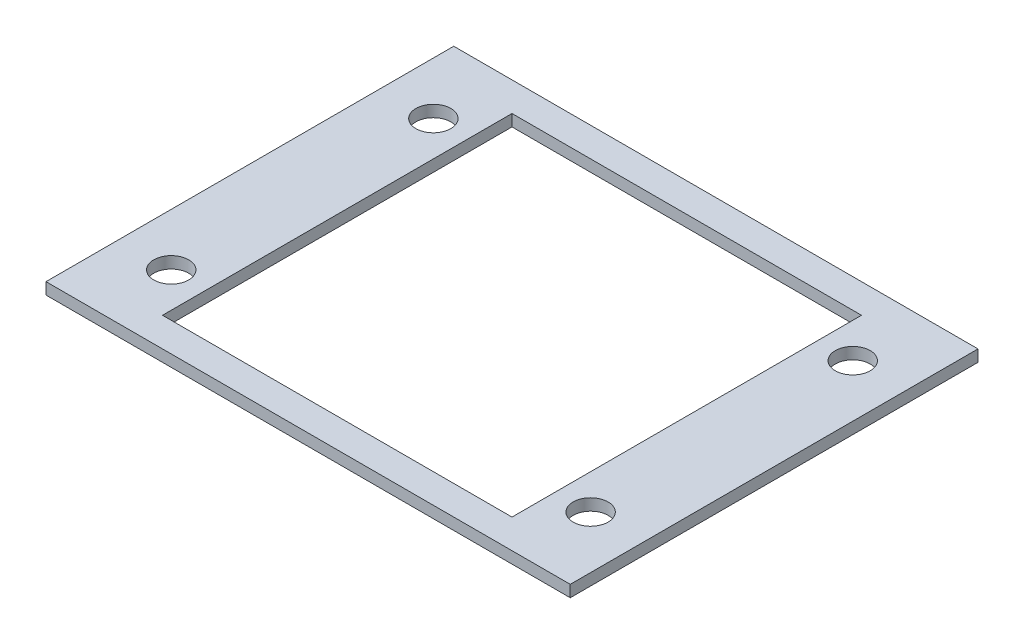
from build123d import *

# Parameters (mm, degrees)
CROQUIS1_R              = 1.5
CROQUIS1_W              = 30
CROQUIS1_H              = 30
SALIENTE_EXTRUIR1_DEPTH = 1
CROQUIS2_W              = 45
CROQUIS2_H              = 5
CORTAR_EXTRUIR1_DEPTH   = 10


with BuildPart() as part:
    # Croquis1 → Saliente-Extruir1 (new body)
    with BuildSketch(Plane(origin=(0, 0, 0), x_dir=(1, 0, 0), z_dir=(0, 1, 0))):
        with BuildLine():
            ThreePointArc((-7.5, -7.398453182), (-7.449747468, -7.449747468), (-7.398453182, -7.5))
            Line((-7.398453182, -7.5), (37.5, -7.5))
            Line((37.5, -7.5), (37.5, 37.5))
            Line((37.5, 37.5), (-7.5, 37.5))
            Line((-7.5, 37.5), (-7.5, -7.398453182))
        make_face()
        with Locations(Location((-3, 3.75, 0), (0, 0, 270))):
            Circle(CROQUIS1_R, mode=Mode.SUBTRACT)
        with Locations(Location((33, 3.75, 0), (0, 0, 270))):
            Circle(CROQUIS1_R, mode=Mode.SUBTRACT)
        with Locations(Location((-3, 26.25, 0), (0, 0, 270))):
            Circle(CROQUIS1_R, mode=Mode.SUBTRACT)
        with Locations((15, 15)):
            Rectangle(CROQUIS1_W, CROQUIS1_H, mode=Mode.SUBTRACT)
        with Locations(Location((33, 26.25, 0), (0, 0, 270))):
            Circle(CROQUIS1_R, mode=Mode.SUBTRACT)
    extrude(amount=SALIENTE_EXTRUIR1_DEPTH)

    # Croquis2 → Cortar-Extruir1 (cut)
    with BuildSketch(Plane(origin=(0, 1, 0), x_dir=(1, 0, 0), z_dir=(0, 1, 0))):
        with Locations((15, 35)):
            Rectangle(CROQUIS2_W, CROQUIS2_H)
        with Locations((15, -5)):
            Rectangle(CROQUIS2_W, CROQUIS2_H)
    extrude(amount=-CORTAR_EXTRUIR1_DEPTH, mode=Mode.SUBTRACT)


solid = part.part
